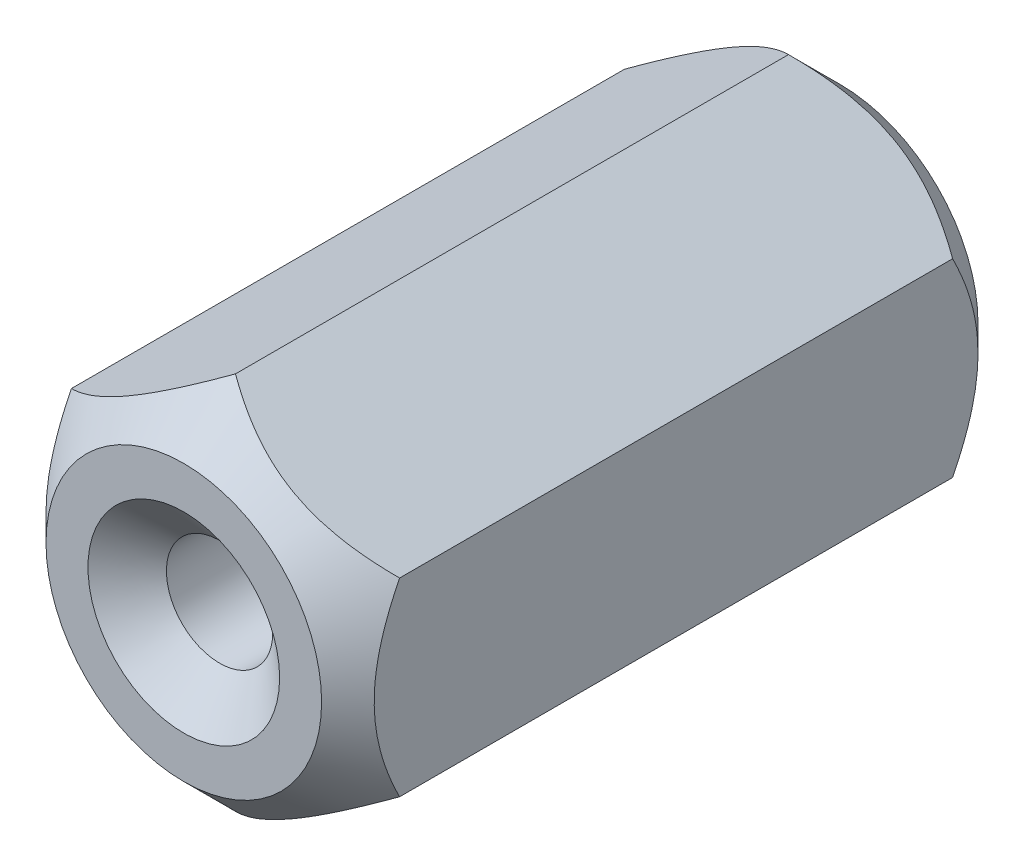
from build123d import *

# Parameters (mm, degrees)
BOSS_EXTRUDE1_DEPTH      = 6.35
BOSS_EXTRUDE1_DEPTH_BACK = 6.35


with BuildPart() as part:
    # Sketch1 → Boss-Extrude1 (new, two sides: drawn at the far end of the back side and taken through both)
    with BuildSketch(Plane.XY.offset(-BOSS_EXTRUDE1_DEPTH_BACK)):
        Polygon((3.175, -1.833087105), (3.175, 1.833087105), (0, 3.666174209), (-3.175, 1.833087105), (-3.175, -1.833087105), (0, -3.666174209), align=None)
    extrude(amount=BOSS_EXTRUDE1_DEPTH + BOSS_EXTRUDE1_DEPTH_BACK)

    # Sketch3 → Cut-Revolve2 (revolve, cut)
    with BuildSketch(Plane(origin=(0, 0, 0), x_dir=(0, 0, -1), z_dir=(1, 0, 0))):
        Polygon((-5.35, 3.666174209), (-6.35, 2.666174209), (-6.35, 3.666174209), align=None)
    cut_revolve2 = revolve(axis=Axis((0, 0, -0.635), (0, 0, 1)), mode=Mode.SUBTRACT)

    # Mirror1: Cut-Revolve2 across plane
    add(cut_revolve2.mirror(Plane.XY), mode=Mode.SUBTRACT)

    # Sketch4 → CSK for #1 Flat Head Machine Screw (100)1 (revolve, cut)
    with BuildSketch(Plane(origin=(0, 0, 6.35), x_dir=(0, -1, 0), z_dir=(1, 0, 0))):
        Polygon((0, 0), (0, 12.7), (1.6637, 12.7), (1.0287, 12.065), (1.0287, 0.692676746), (1.8542, 0), align=None)
    revolve(axis=Axis((0, 0, 12.7), (0, 0, -1)), mode=Mode.SUBTRACT)


solid = part.part
